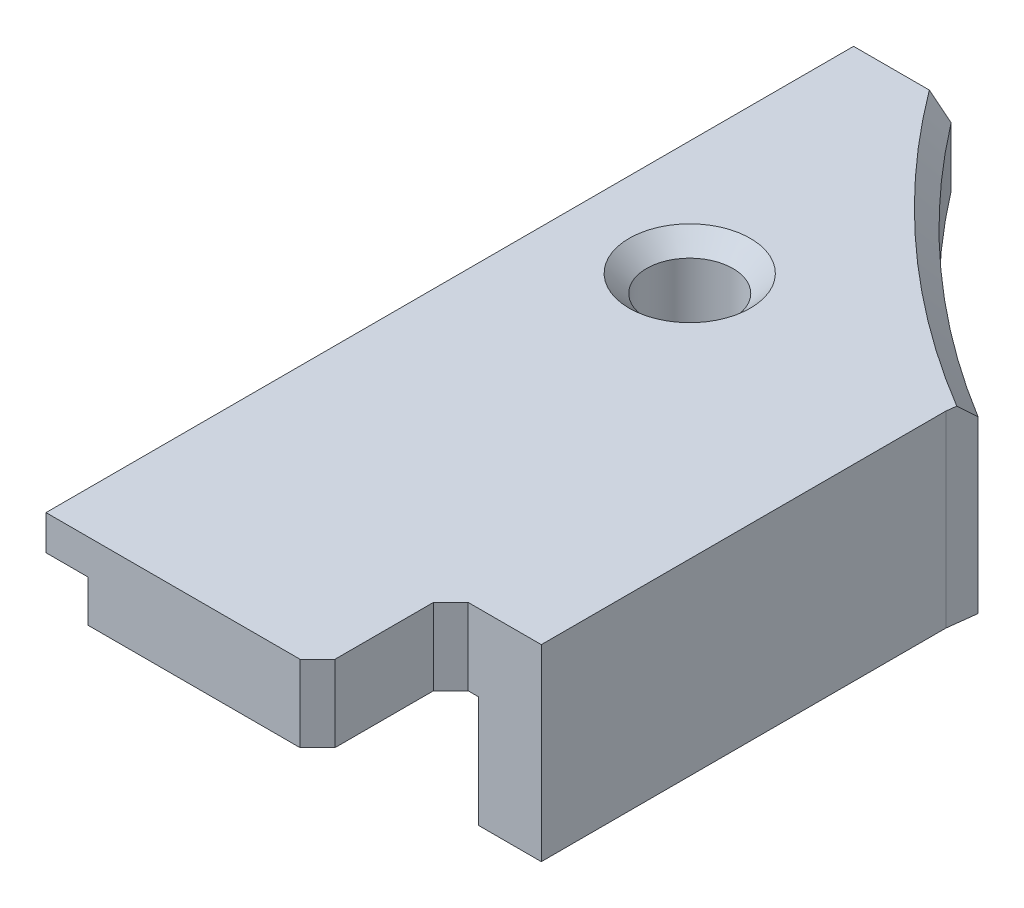
from build123d import *

# Parameters (mm, degrees)
SKETCH_219_R           = 1.55
EXTRUDE_1_DEPTH        = 2.75
SKETCH_940_W           = 10.000000002
SKETCH_940_H           = 4.75
EXTRUDE_2_DEPTH        = 2.75
SKETCH_1087_W          = 1
SKETCH_1087_H          = 6.95
EXTRUDE_1846_DEPTH     = 2.75
PCB_START              = -4
SKETCH_6_W             = 1
SKETCH_6_H             = 6.95
PCB_DEPTH              = 4
SKETCH_4_W             = 1.75
SKETCH_4_H             = 28.99988509
CUT_EXTRUDE_2332_DEPTH = 1.5
SKETCH_5_W             = 0.25
SKETCH_5_H             = 28.99988509
CUT_EXTRUDE_2_DEPTH    = 33.350081892
CHAMFER_1_SIZE         = 0.625
CUT_EXTRUDE_4_DEPTH    = 4


with BuildPart() as part:
    # Sketch 219 → 底座-1 (new body)
    with BuildSketch(Plane(origin=(0, 0, 0), x_dir=(1, 0, 0), z_dir=(0, 1, 0))):
        with BuildLine():
            Line((22.500000002, -14.24988509), (22.500000002, -7.263629174))
            Line((22.500000002, -7.263629174), (24.500000002, -7.263629174))
            Line((24.500000002, -7.263629174), (24.500000002, 0.312480077))
            Line((24.500000002, 0.312480077), (24.715186194, 2.08073674))
            ThreePointArc((24.715186194, 2.08073674), (20.15501929, 5.688743466), (16.252981126, 10))
            Line((16.252981126, 10), (12.5, 10))
            Line((12.5, 10), (12.5, -14.24988509))
            Line((12.5, -14.24988509), (22.500000002, -14.24988509))
        make_face()
        with Locations(Location((16.865979255, 0, 0), (0, 0, 270))):
            Circle(SKETCH_219_R, mode=Mode.SUBTRACT)
    extrude(amount=EXTRUDE_1_DEPTH)

    # Sketch 940 → 底座-2 (add)
    with BuildSketch(Plane(origin=(0, 0, 0), x_dir=(1, 0, 0), z_dir=(0, 1, 0))):
        with Locations((17.500000001, -16.62488509)):
            Rectangle(SKETCH_940_W, SKETCH_940_H)
    extrude(amount=EXTRUDE_2_DEPTH)

    # Sketch 1087 → Extrude 1846 (add)
    with BuildSketch(Plane(origin=(0, 0, 0), x_dir=(1, 0, 0), z_dir=(0, 1, 0))):
        with BuildLine():
            ThreePointArc((24.715186194, 2.08073674), (25.291636518, 1.705823535), (25.875319612, 1.342273079))
            Line((25.875319612, 1.342273079), (25.750000002, 0.312480077))
            Line((25.750000002, 0.312480077), (25.750000002, -14.213629174))
            Line((25.750000002, -14.213629174), (24.500000002, -14.213629174))
            Line((24.500000002, -14.213629174), (24.500000002, -7.263629174))
            Line((24.500000002, -7.263629174), (24.500000002, 0.312480077))
            Line((24.500000002, 0.312480077), (24.715186194, 2.08073674))
        make_face()
        with Locations((24.000000002, -10.738629174)):
            Rectangle(SKETCH_1087_W, SKETCH_1087_H)
        with Locations((23.000000002, -10.738629174)):
            Rectangle(SKETCH_1087_W, SKETCH_1087_H)
    extrude(amount=EXTRUDE_1846_DEPTH)

    # Sketch 6 → 底座卡榫-注意PCB突出部分 (add)
    with BuildSketch(Plane(origin=(0, 0, 0), x_dir=(1, 0, 0), z_dir=(0, 1, 0)).offset(PCB_START)):
        with Locations((24.000000002, -10.738629174)):
            Rectangle(SKETCH_6_W, SKETCH_6_H)
        with BuildLine():
            ThreePointArc((24.715186194, 2.08073674), (25.291636518, 1.705823535), (25.875319612, 1.342273079))
            Line((25.875319612, 1.342273079), (25.750000002, 0.312480077))
            Line((25.750000002, 0.312480077), (25.750000002, -14.213629174))
            Line((25.750000002, -14.213629174), (24.500000002, -14.213629174))
            Line((24.500000002, -14.213629174), (24.500000002, -7.263629174))
            Line((24.500000002, -7.263629174), (24.500000002, 0.312480077))
            Line((24.500000002, 0.312480077), (24.715186194, 2.08073674))
        make_face()
    extrude(amount=PCB_DEPTH)

    # 草图4 → Cut-Extrude 2332 (cut)
    with BuildSketch(Plane(origin=(0, 0, 0), x_dir=(1, 0, 0), z_dir=(0, 1, 0))):
        with Locations((13.375, -4.499942545)):
            Rectangle(SKETCH_4_W, SKETCH_4_H)
    extrude(amount=CUT_EXTRUDE_2332_DEPTH, mode=Mode.SUBTRACT)

    # 草图5 → 配合切除-2 (cut, through all)
    with BuildSketch(Plane(origin=(0, 0, 0), x_dir=(1, 0, 0), z_dir=(0, 1, 0))):
        with Locations((12.625, -4.499942545)):
            Rectangle(SKETCH_5_W, SKETCH_5_H)
    extrude(amount=CUT_EXTRUDE_2_DEPTH, mode=Mode.SUBTRACT)

    # 倒角1
    chamfer_1_edges = [part.edges().sort_by_distance(p)[0] for p in [
        (22.500000002, 1.375, 18.99988509),
        (22.500000002, 1.375, 14.213629174),
        (16.865979255, 2.75, -1.55),
        (20.661675073, 2.75, -5.223818951),
    ]]
    chamfer(chamfer_1_edges, length=CHAMFER_1_SIZE)

    # Sketch 6 2 → 切除-拉伸4 (cut)
    with BuildSketch(Plane.XZ.offset(4)):
        with BuildLine():
            Line((24.715186194, -2.08073674), (24.500000002, -0.312480077))
            Line((24.500000002, -0.312480077), (24.500000002, 7.263629174))
            Line((24.500000002, 7.263629174), (23.500000002, 7.263629174))
            Line((23.500000002, 7.263629174), (23.500000002, 7.513629174))
            Line((23.500000002, 7.513629174), (24.750000002, 7.513629174))
            Line((24.750000002, 7.513629174), (24.750000002, -0.312480077))
            Line((24.750000002, -0.312480077), (24.946632534, -1.928275128))
            ThreePointArc((24.946632534, -1.928275128), (24.830758909, -2.004277534), (24.715186194, -2.08073674))
        make_face()
    extrude(amount=-CUT_EXTRUDE_4_DEPTH, mode=Mode.SUBTRACT)


solid = part.part
